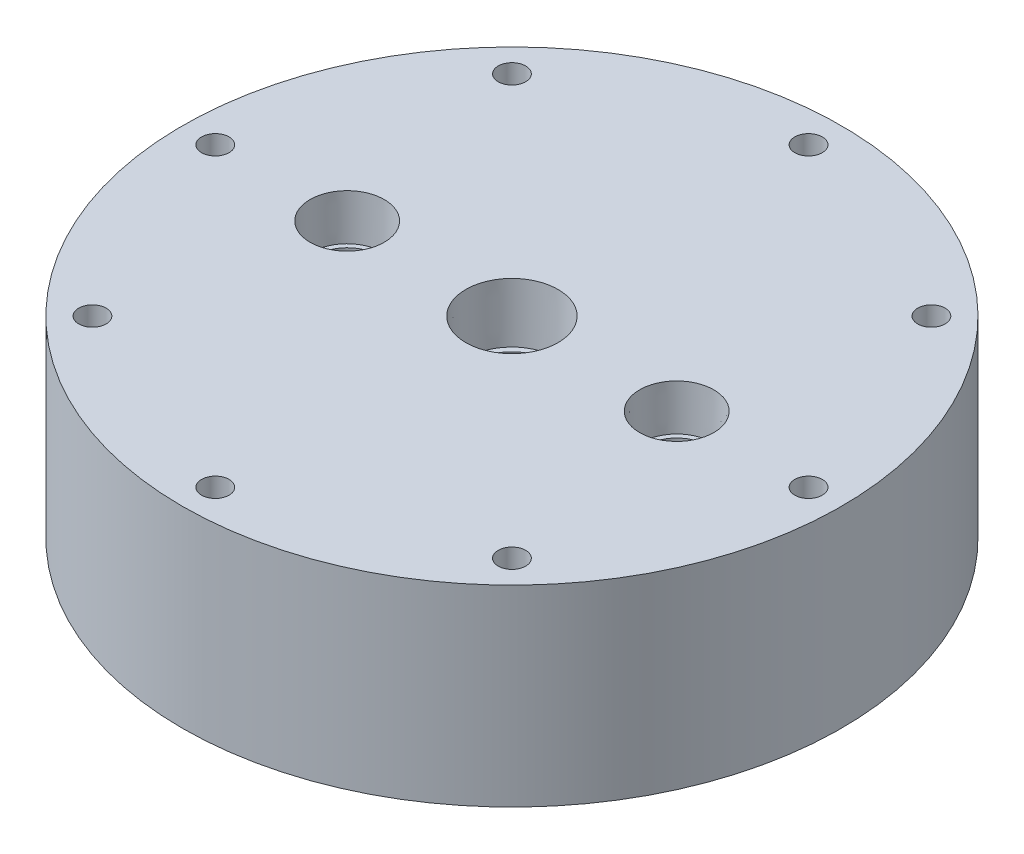
from build123d import *

# Parameters (mm, degrees)
F_3_8_NPT_TAPPED_HOLE1_AT_2_COUNT = 2
F_3_8_NPT_TAPPED_HOLE1_AT_2_PITCH = 76.2
BOLT_HOLES_PROFILE_R              = 3.175
BOLT_HOLES_DEPTH                  = 117.570504417
DOWEL_HOLES_PROFILE_R             = 1.27
DOWEL_HOLES_DEPTH                 = 2.54


with BuildPart() as part:
    # Main Shape Profile → Main Shape (revolve)
    with BuildSketch(Plane.XY, mode=Mode.PRIVATE) as main_shape_sk:
        Polygon((0, 44.45), (0, 22.86), (22.225, 22.86), (22.225, 12.7), (25.4, 12.7), (25.4, 14.732), (27.432, 14.732), (27.432, 12.7), (28.575, 12.7), (28.575, 6.35), (57.15, 6.35), (57.15, 0), (76.2, 0), (76.2, 44.45), align=None)
    revolve(main_shape_sk.sketch.rotate(Axis((0, 0, 0), (0, -1, 0)), 90), axis=Axis((0, 0, 0), (0, -1, 0)))

    # Sketch3 → 1/2 NPT Tapped Hole1 (revolve, cut)
    with BuildSketch(Plane(origin=(0, 44.45, 0), x_dir=(0, 0, 1), z_dir=(1, 0, 0))):
        Polygon((0, 0), (0, 44.45), (8.9281, 44.45), (8.9281, 13.462), (10.261665792, 13.462), (10.6647361, 0), align=None)
    revolve(axis=Axis((0, 50.8, 0), (0, -1, 0)), mode=Mode.SUBTRACT)

    # Sketch4 → 3/8 NPT Tapped Hole1 (revolve, cut)
    with BuildSketch(Plane(origin=(-38.1, 44.45, 0), x_dir=(0, 0, 1), z_dir=(1, 0, 0))):
        Polygon((0, 0), (0, 44.45), (7.1374, 44.45), (7.1374, 10.414), (8.263205494, 10.414), (8.5750146, 0), align=None)
    f_3_8_npt_tapped_hole1 = revolve(axis=Axis((-38.1, 50.8, 0), (0, -1, 0)), mode=Mode.SUBTRACT)

    # 3/8 NPT Tapped Hole1 at 2: 3/8 NPT Tapped Hole1 ×2
    with Locations(*[(i * F_3_8_NPT_TAPPED_HOLE1_AT_2_PITCH, 0, 0) for i in range(1, F_3_8_NPT_TAPPED_HOLE1_AT_2_COUNT)]):
        add(f_3_8_npt_tapped_hole1, mode=Mode.SUBTRACT)

    # Bolt Holes Profile → Bolt Holes (cut, through all)
    with BuildSketch(Plane(origin=(0, 44.45, 0), x_dir=(1, 0, 0), z_dir=(0, 1, 0))):
        with Locations(Location((0, 68.58, 0), (0, 0, 270))):
            Circle(BOLT_HOLES_PROFILE_R)
        with Locations(Location((48.493383054, 48.493383054, 0), (0, 0, 270))):
            Circle(BOLT_HOLES_PROFILE_R)
        with Locations(Location((68.58, 0, 0), (0, 0, 270))):
            Circle(BOLT_HOLES_PROFILE_R)
        with Locations(Location((48.493383054, -48.493383054, 0), (0, 0, 270))):
            Circle(BOLT_HOLES_PROFILE_R)
        with Locations(Location((0, -68.58, 0), (0, 0, 270))):
            Circle(BOLT_HOLES_PROFILE_R)
        with Locations(Location((-48.493383054, -48.493383054, 0), (0, 0, 270))):
            Circle(BOLT_HOLES_PROFILE_R)
        with Locations(Location((-68.58, 0, 0), (0, 0, 270))):
            Circle(BOLT_HOLES_PROFILE_R)
        with Locations(Location((-48.493383054, 48.493383054, 0), (0, 0, 270))):
            Circle(BOLT_HOLES_PROFILE_R)
    extrude(amount=-BOLT_HOLES_DEPTH, mode=Mode.SUBTRACT)

    # Dowel Holes Profile → Dowel Holes (cut)
    with BuildSketch(Plane.XZ.offset(-6.35)):
        with Locations(Location((0, 46.355, 0), (0, 0, 270))):
            Circle(DOWEL_HOLES_PROFILE_R)
        with Locations(Location((0, -46.355, 0), (0, 0, 270))):
            Circle(DOWEL_HOLES_PROFILE_R)
    extrude(amount=-DOWEL_HOLES_DEPTH, mode=Mode.SUBTRACT)


solid = part.part
